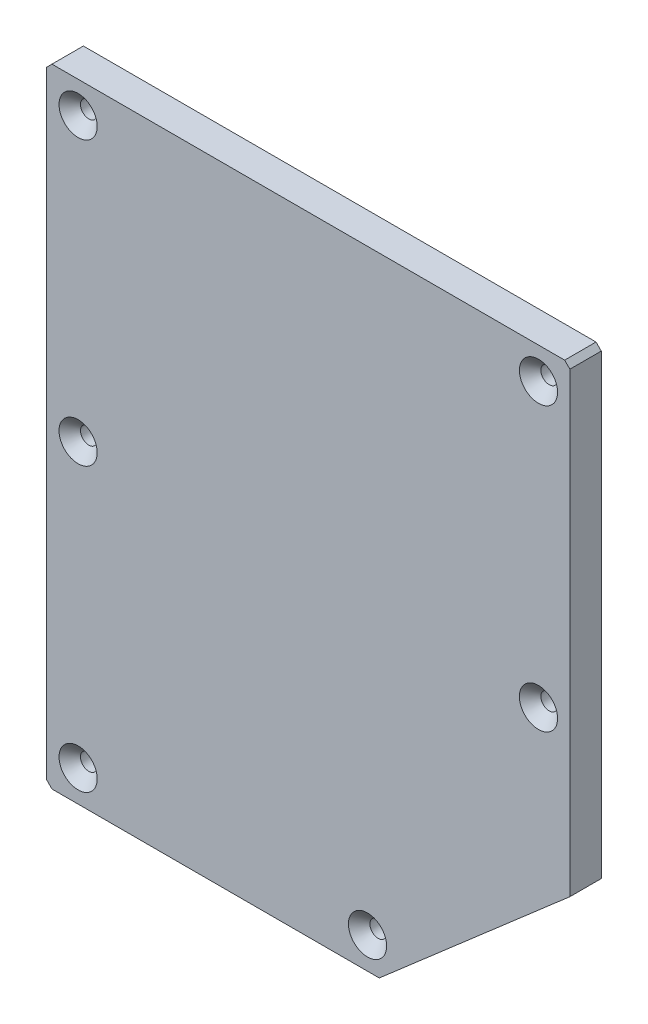
from build123d import *

# Parameters (mm, degrees)
BOSS_EXTRUDE1_DEPTH                                 = 6
CSK_FOR_M3_COUNTERSUNK_FLAT_HEAD_SCREW1_D           = 3.2
CSK_FOR_M3_COUNTERSUNK_FLAT_HEAD_SCREW1_CSINK_D     = 7.3
CSK_FOR_M3_COUNTERSUNK_FLAT_HEAD_SCREW1_CSINK_ANGLE = 90


with BuildPart() as part:
    # Sketch1 → Boss-Extrude1 (new body)
    with BuildSketch(Plane.XY):
        Polygon((-40, 42.599696279), (-40, -75.400303721), (-39, -76.400303721), (23.564831516, -76.400303721), (60, -44.727694967), (60, 42.599696279), (59, 43.599696279), (-39, 43.599696279), align=None)
    extrude(amount=BOSS_EXTRUDE1_DEPTH)

    # CSK for M3 Countersunk Flat Head Screw1 (through all)
    with Locations(Plane(origin=(-34, 37.599696279, 6), x_dir=(1, 0, 0), z_dir=(0, 0, 1))):
        with Locations((0, 0), (88, 0), (88, -54), (0, -54), (0, -108), (55.321523439, -108)):
            CounterSinkHole(CSK_FOR_M3_COUNTERSUNK_FLAT_HEAD_SCREW1_D / 2, CSK_FOR_M3_COUNTERSUNK_FLAT_HEAD_SCREW1_CSINK_D / 2, counter_sink_angle=CSK_FOR_M3_COUNTERSUNK_FLAT_HEAD_SCREW1_CSINK_ANGLE)


solid = part.part
